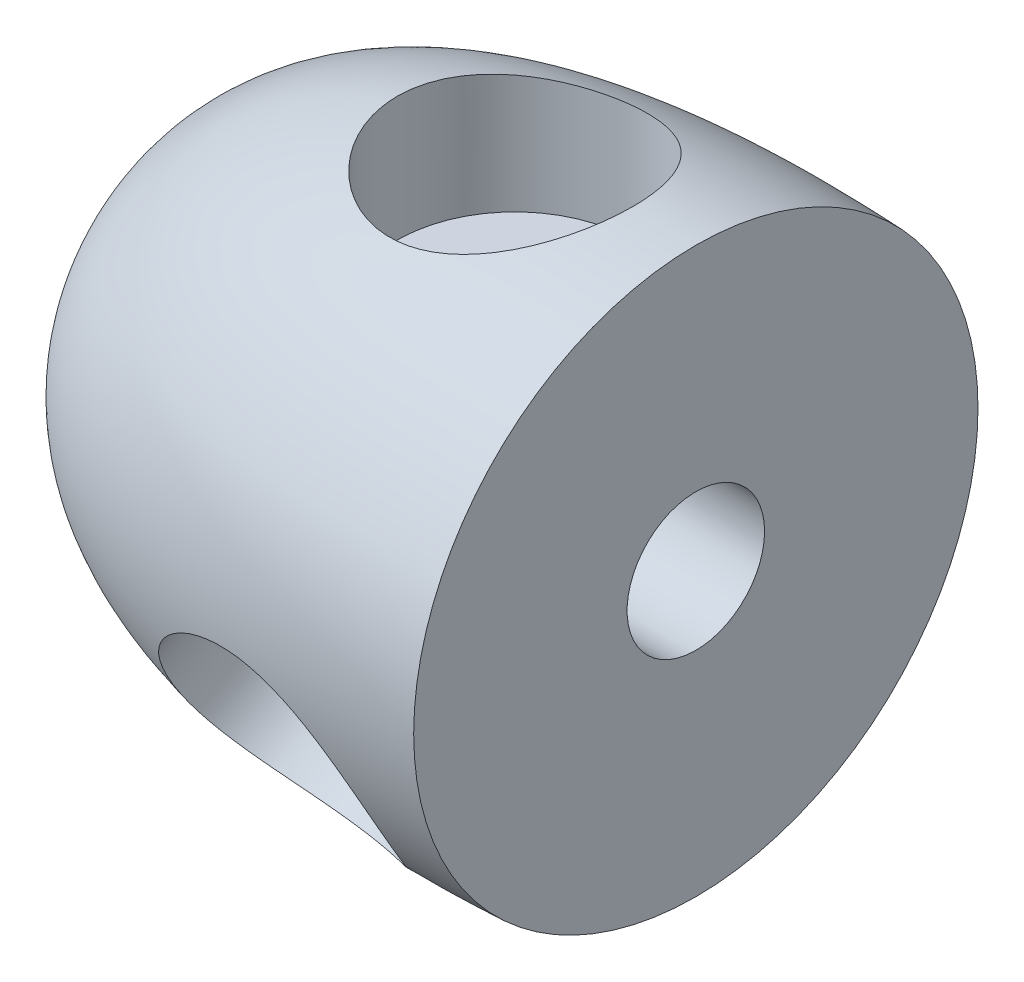
from build123d import *

# Parameters (mm, degrees)
SKETCH17_R         = 4.826
CUT_EXTRUDE3_DEPTH = 12.7
SKETCH19_R         = 8.255
CUT_EXTRUDE4_DEPTH = 10.16
CIRPATTERN1_COUNT  = 3


with BuildPart() as part:
    # Sketch16 → Revolve5 (revolve)
    with BuildSketch(Plane.XY):
        with BuildLine():
            Line((0, 0), (38.1, 0))
            Line((38.1, 0), (38.1, 19.812))
            add(Edge.make_bspline(
                [(0, 0), (0, 21.471640273), (38.1, 19.812)],
                knots=[0, 0, 0, 1, 1, 1], degree=2))
        make_face()
    revolve(axis=Axis((0, 0, 0), (1, 0, 0)))

    # Sketch17 → Cut-Extrude3 (cut)
    with BuildSketch(Plane(origin=(38.1, 0, 0), x_dir=(0, 0, -1), z_dir=(1, 0, 0))):
        Circle(SKETCH17_R)
    extrude(amount=-CUT_EXTRUDE3_DEPTH, mode=Mode.SUBTRACT)

    # Sketch19 → Cut-Extrude4 (cut, symmetric)
    with BuildSketch(Plane(origin=(0, 19.812, 0), x_dir=(1, 0, 0), z_dir=(0, 1, 0))):
        with Locations(Location((25.4, 0, 0), (0, 0, 270))):
            Circle(SKETCH19_R)
    cut_extrude4 = extrude(amount=CUT_EXTRUDE4_DEPTH, both=True, mode=Mode.SUBTRACT)

    # CirPattern1: Cut-Extrude4 ×3 about axis
    cirpattern1_axis = Axis((0, 0, 0), (1, 0, 0))
    for i in range(1, CIRPATTERN1_COUNT):
        add(cut_extrude4.rotate(cirpattern1_axis, i * 360 / CIRPATTERN1_COUNT), mode=Mode.SUBTRACT)


solid = part.part
